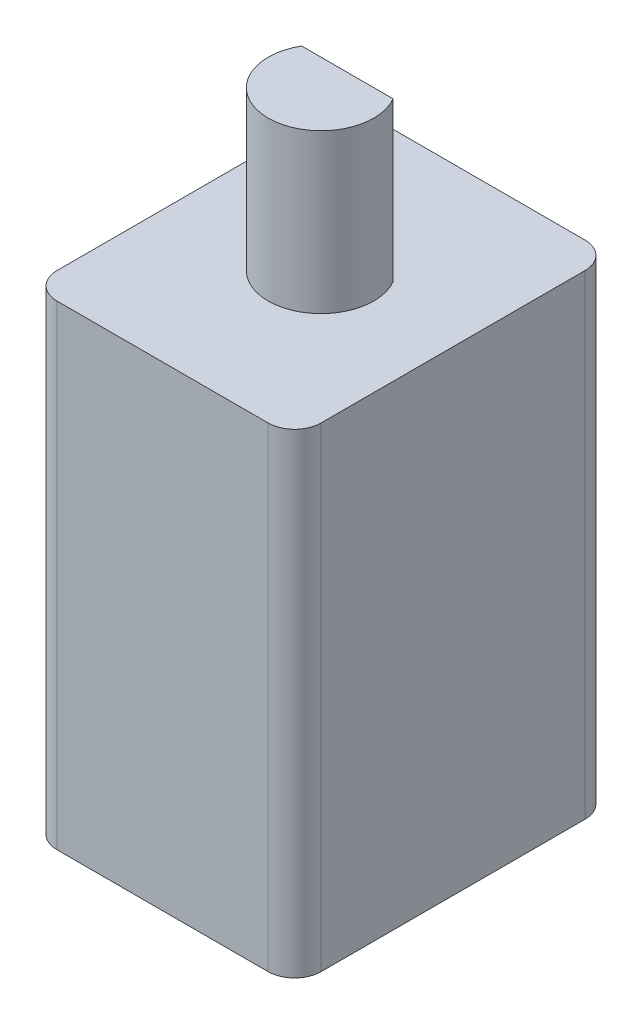
from build123d import *

# Parameters (mm, degrees)
CROQUIS1_W              = 10
CROQUIS1_H              = 12
SALIENTE_EXTRUIR1_DEPTH = 18
SALIENTE_EXTRUIR2_DEPTH = 6
REDONDEO1_R             = 1


with BuildPart() as part:
    # Croquis1 → Saliente-Extruir1 (new body)
    with BuildSketch(Plane(origin=(0, 0, 0), x_dir=(1, 0, 0), z_dir=(0, 1, 0))):
        Rectangle(CROQUIS1_W, CROQUIS1_H)
    extrude(amount=SALIENTE_EXTRUIR1_DEPTH)

    # Croquis2 → Saliente-Extruir2 (add)
    with BuildSketch(Plane(origin=(0, 18, 0), x_dir=(1, 0, 0), z_dir=(0, 1, 0))):
        with BuildLine():
            Line((-1.732050808, 1), (1.732050808, 1))
            ThreePointArc((1.732050808, 1), (0, -2), (-1.732050808, 1))
        make_face()
    extrude(amount=SALIENTE_EXTRUIR2_DEPTH)

    # Redondeo1
    redondeo1_edges = [part.edges().sort_by_distance(p)[0] for p in [
        (5, 9, 6),
        (-5, 9, 6),
        (-5, 9, -6),
        (5, 9, -6),
    ]]
    fillet(redondeo1_edges, radius=REDONDEO1_R)


solid = part.part
